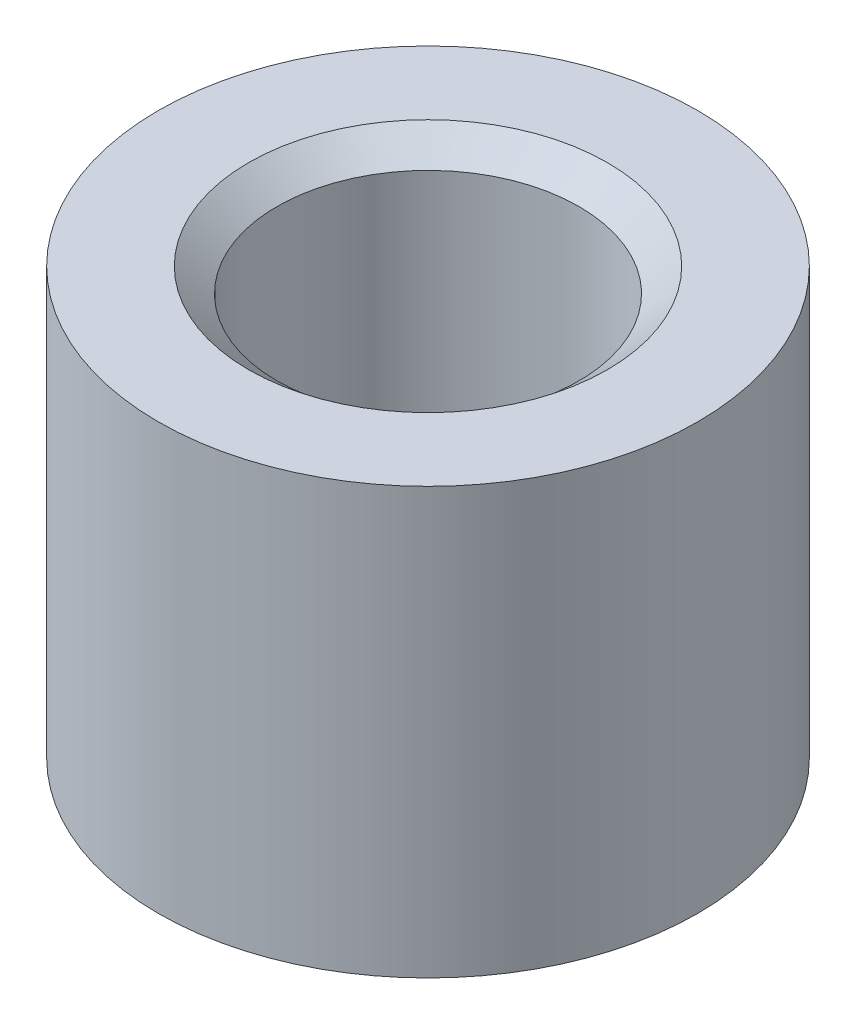
from build123d import *

# Parameters (mm, degrees)
SKETCH1_R                         = 6.0325
BOSS_EXTRUDE1_DEPTH               = 9.525
F_1_4_CLEARANCE_HOLE1_D           = 6.7564
F_1_4_CLEARANCE_HOLE1_CSINK_D     = 8.0264
F_1_4_CLEARANCE_HOLE1_CSINK_ANGLE = 100


with BuildPart() as part:
    # Sketch1 → Boss-Extrude1 (new body)
    with BuildSketch(Plane(origin=(0, 0, 0), x_dir=(1, 0, 0), z_dir=(0, 1, 0))):
        with Locations(Location((0, 0, 0), (0, 0, 90))):
            Circle(SKETCH1_R)
    extrude(amount=BOSS_EXTRUDE1_DEPTH)

    # 1/4 Clearance Hole1 (through all)
    with Locations(Plane(origin=(0, 9.525, 0), x_dir=(1, 0, 0), z_dir=(0, 1, 0))):
        with Locations((0, 0)):
            CounterSinkHole(F_1_4_CLEARANCE_HOLE1_D / 2, F_1_4_CLEARANCE_HOLE1_CSINK_D / 2, counter_sink_angle=F_1_4_CLEARANCE_HOLE1_CSINK_ANGLE)


solid = part.part
